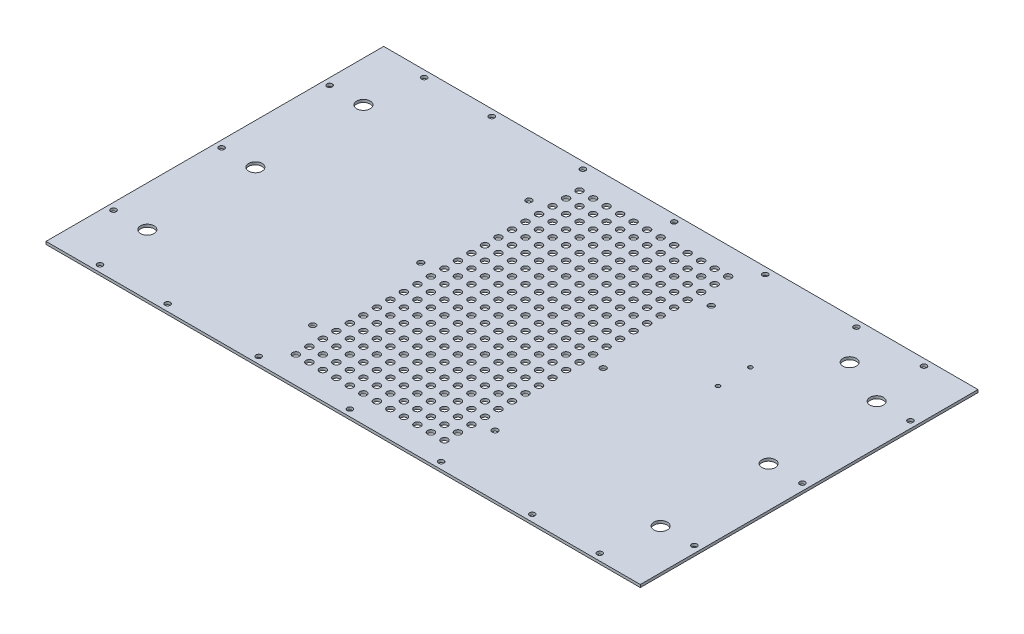
from build123d import *

# Parameters (mm, degrees)
CROQUIS1_W              = 440
CROQUIS1_H              = 250
CROQUIS1_R              = 5
CROQUIS1_R_2            = 2.175
CROQUIS1_W_2            = 120
CROQUIS1_H_2            = 220
SALIENTE_EXTRUIR1_DEPTH = 2
CROQUIS4_W              = 120
CROQUIS4_H              = 220
CROQUIS4_R              = 2.5
SALIENTE_EXTRUIR4_DEPTH = 2
CROQUIS5_R              = 2
CORTAR_EXTRUIR1_DEPTH   = 10
CROQUIS6_R              = 1.5
CORTAR_EXTRUIR2_DEPTH   = 10


with BuildPart() as part:
    # Croquis1 → Saliente-Extruir1 (new body)
    with BuildSketch(Plane(origin=(0, 0, 0), x_dir=(1, 0, 0), z_dir=(0, 1, 0))):
        Rectangle(CROQUIS1_W, CROQUIS1_H)
        with Locations(Location((-190, -80, 0), (0, 0, 270))):
            Circle(CROQUIS1_R, mode=Mode.SUBTRACT)
        with Locations(Location((-190, 0, 0), (0, 0, 270))):
            Circle(CROQUIS1_R, mode=Mode.SUBTRACT)
        with Locations(Location((-190, 80, 0), (0, 0, 270))):
            Circle(CROQUIS1_R, mode=Mode.SUBTRACT)
        with Locations(Location((67.5, 80, 0), (0, 0, 270))):
            Circle(CROQUIS1_R_2, mode=Mode.SUBTRACT)
        with Locations(Location((-67.5, -80, 0), (0, 0, 270))):
            Circle(CROQUIS1_R_2, mode=Mode.SUBTRACT)
        with Locations(Location((-67.5, 0, 0), (0, 0, 270))):
            Circle(CROQUIS1_R_2, mode=Mode.SUBTRACT)
        with Locations(Location((67.5, -80, 0), (0, 0, 270))):
            Circle(CROQUIS1_R_2, mode=Mode.SUBTRACT)
        with Locations(Location((67.5, 0, 0), (0, 0, 270))):
            Circle(CROQUIS1_R_2, mode=Mode.SUBTRACT)
        Rectangle(CROQUIS1_W_2, CROQUIS1_H_2, mode=Mode.SUBTRACT)
        with Locations(Location((-67.5, 80, 0), (0, 0, 270))):
            Circle(CROQUIS1_R_2, mode=Mode.SUBTRACT)
        with Locations(Location((155, 95, 0), (0, 0, 270))):
            Circle(CROQUIS1_R, mode=Mode.SUBTRACT)
        with Locations(Location((190, -80, 0), (0, 0, 270))):
            Circle(CROQUIS1_R, mode=Mode.SUBTRACT)
        with Locations(Location((190, 0, 0), (0, 0, 270))):
            Circle(CROQUIS1_R, mode=Mode.SUBTRACT)
        with Locations(Location((190, 80, 0), (0, 0, 270))):
            Circle(CROQUIS1_R, mode=Mode.SUBTRACT)
    extrude(amount=SALIENTE_EXTRUIR1_DEPTH)

    # Croquis4 → Saliente-Extruir4 (add)
    with BuildSketch(Plane(origin=(0, 2, 0), x_dir=(1, 0, 0), z_dir=(0, 1, 0))):
        Rectangle(CROQUIS4_W, CROQUIS4_H)
        with Locations(Location((-55, 105, 0), (0, 0, 270))):
            Circle(CROQUIS4_R, mode=Mode.SUBTRACT)
        with Locations(Location((-45, 105, 0), (0, 0, 270))):
            Circle(CROQUIS4_R, mode=Mode.SUBTRACT)
        with Locations(Location((-35, 105, 0), (0, 0, 270))):
            Circle(CROQUIS4_R, mode=Mode.SUBTRACT)
        with Locations(Location((-25, 105, 0), (0, 0, 270))):
            Circle(CROQUIS4_R, mode=Mode.SUBTRACT)
        with Locations(Location((-15, 105, 0), (0, 0, 270))):
            Circle(CROQUIS4_R, mode=Mode.SUBTRACT)
        with Locations(Location((-5, 105, 0), (0, 0, 270))):
            Circle(CROQUIS4_R, mode=Mode.SUBTRACT)
        with Locations(Location((5, 105, 0), (0, 0, 270))):
            Circle(CROQUIS4_R, mode=Mode.SUBTRACT)
        with Locations(Location((15, 105, 0), (0, 0, 270))):
            Circle(CROQUIS4_R, mode=Mode.SUBTRACT)
        with Locations(Location((25, 105, 0), (0, 0, 270))):
            Circle(CROQUIS4_R, mode=Mode.SUBTRACT)
        with Locations(Location((35, 105, 0), (0, 0, 270))):
            Circle(CROQUIS4_R, mode=Mode.SUBTRACT)
        with Locations(Location((45, 105, 0), (0, 0, 270))):
            Circle(CROQUIS4_R, mode=Mode.SUBTRACT)
        with Locations(Location((-45, 95, 0), (0, 0, 270))):
            Circle(CROQUIS4_R, mode=Mode.SUBTRACT)
        with Locations(Location((-35, 95, 0), (0, 0, 270))):
            Circle(CROQUIS4_R, mode=Mode.SUBTRACT)
        with Locations(Location((-25, 95, 0), (0, 0, 270))):
            Circle(CROQUIS4_R, mode=Mode.SUBTRACT)
        with Locations(Location((-15, 95, 0), (0, 0, 270))):
            Circle(CROQUIS4_R, mode=Mode.SUBTRACT)
        with Locations(Location((-5, 95, 0), (0, 0, 270))):
            Circle(CROQUIS4_R, mode=Mode.SUBTRACT)
        with Locations(Location((5, 95, 0), (0, 0, 270))):
            Circle(CROQUIS4_R, mode=Mode.SUBTRACT)
        with Locations(Location((15, 95, 0), (0, 0, 270))):
            Circle(CROQUIS4_R, mode=Mode.SUBTRACT)
        with Locations(Location((25, 95, 0), (0, 0, 270))):
            Circle(CROQUIS4_R, mode=Mode.SUBTRACT)
        with Locations(Location((35, 95, 0), (0, 0, 270))):
            Circle(CROQUIS4_R, mode=Mode.SUBTRACT)
        with Locations(Location((45, 95, 0), (0, 0, 270))):
            Circle(CROQUIS4_R, mode=Mode.SUBTRACT)
        with Locations(Location((-45, 85, 0), (0, 0, 270))):
            Circle(CROQUIS4_R, mode=Mode.SUBTRACT)
        with Locations(Location((-35, 85, 0), (0, 0, 270))):
            Circle(CROQUIS4_R, mode=Mode.SUBTRACT)
        with Locations(Location((-25, 85, 0), (0, 0, 270))):
            Circle(CROQUIS4_R, mode=Mode.SUBTRACT)
        with Locations(Location((-15, 85, 0), (0, 0, 270))):
            Circle(CROQUIS4_R, mode=Mode.SUBTRACT)
        with Locations(Location((-5, 85, 0), (0, 0, 270))):
            Circle(CROQUIS4_R, mode=Mode.SUBTRACT)
        with Locations(Location((5, 85, 0), (0, 0, 270))):
            Circle(CROQUIS4_R, mode=Mode.SUBTRACT)
        with Locations(Location((15, 85, 0), (0, 0, 270))):
            Circle(CROQUIS4_R, mode=Mode.SUBTRACT)
        with Locations(Location((25, 85, 0), (0, 0, 270))):
            Circle(CROQUIS4_R, mode=Mode.SUBTRACT)
        with Locations(Location((35, 85, 0), (0, 0, 270))):
            Circle(CROQUIS4_R, mode=Mode.SUBTRACT)
        with Locations(Location((45, 85, 0), (0, 0, 270))):
            Circle(CROQUIS4_R, mode=Mode.SUBTRACT)
        with Locations(Location((-45, 75, 0), (0, 0, 270))):
            Circle(CROQUIS4_R, mode=Mode.SUBTRACT)
        with Locations(Location((-35, 75, 0), (0, 0, 270))):
            Circle(CROQUIS4_R, mode=Mode.SUBTRACT)
        with Locations(Location((-25, 75, 0), (0, 0, 270))):
            Circle(CROQUIS4_R, mode=Mode.SUBTRACT)
        with Locations(Location((-15, 75, 0), (0, 0, 270))):
            Circle(CROQUIS4_R, mode=Mode.SUBTRACT)
        with Locations(Location((-5, 75, 0), (0, 0, 270))):
            Circle(CROQUIS4_R, mode=Mode.SUBTRACT)
        with Locations(Location((5, 75, 0), (0, 0, 270))):
            Circle(CROQUIS4_R, mode=Mode.SUBTRACT)
        with Locations(Location((15, 75, 0), (0, 0, 270))):
            Circle(CROQUIS4_R, mode=Mode.SUBTRACT)
        with Locations(Location((25, 75, 0), (0, 0, 270))):
            Circle(CROQUIS4_R, mode=Mode.SUBTRACT)
        with Locations(Location((35, 75, 0), (0, 0, 270))):
            Circle(CROQUIS4_R, mode=Mode.SUBTRACT)
        with Locations(Location((45, 75, 0), (0, 0, 270))):
            Circle(CROQUIS4_R, mode=Mode.SUBTRACT)
        with Locations(Location((-45, 65, 0), (0, 0, 270))):
            Circle(CROQUIS4_R, mode=Mode.SUBTRACT)
        with Locations(Location((-35, 65, 0), (0, 0, 270))):
            Circle(CROQUIS4_R, mode=Mode.SUBTRACT)
        with Locations(Location((-25, 65, 0), (0, 0, 270))):
            Circle(CROQUIS4_R, mode=Mode.SUBTRACT)
        with Locations(Location((-15, 65, 0), (0, 0, 270))):
            Circle(CROQUIS4_R, mode=Mode.SUBTRACT)
        with Locations(Location((-5, 65, 0), (0, 0, 270))):
            Circle(CROQUIS4_R, mode=Mode.SUBTRACT)
        with Locations(Location((5, 65, 0), (0, 0, 270))):
            Circle(CROQUIS4_R, mode=Mode.SUBTRACT)
        with Locations(Location((15, 65, 0), (0, 0, 270))):
            Circle(CROQUIS4_R, mode=Mode.SUBTRACT)
        with Locations(Location((25, 65, 0), (0, 0, 270))):
            Circle(CROQUIS4_R, mode=Mode.SUBTRACT)
        with Locations(Location((35, 65, 0), (0, 0, 270))):
            Circle(CROQUIS4_R, mode=Mode.SUBTRACT)
        with Locations(Location((45, 65, 0), (0, 0, 270))):
            Circle(CROQUIS4_R, mode=Mode.SUBTRACT)
        with Locations(Location((-45, 55, 0), (0, 0, 270))):
            Circle(CROQUIS4_R, mode=Mode.SUBTRACT)
        with Locations(Location((-35, 55, 0), (0, 0, 270))):
            Circle(CROQUIS4_R, mode=Mode.SUBTRACT)
        with Locations(Location((-25, 55, 0), (0, 0, 270))):
            Circle(CROQUIS4_R, mode=Mode.SUBTRACT)
        with Locations(Location((-15, 55, 0), (0, 0, 270))):
            Circle(CROQUIS4_R, mode=Mode.SUBTRACT)
        with Locations(Location((-5, 55, 0), (0, 0, 270))):
            Circle(CROQUIS4_R, mode=Mode.SUBTRACT)
        with Locations(Location((5, 55, 0), (0, 0, 270))):
            Circle(CROQUIS4_R, mode=Mode.SUBTRACT)
        with Locations(Location((15, 55, 0), (0, 0, 270))):
            Circle(CROQUIS4_R, mode=Mode.SUBTRACT)
        with Locations(Location((25, 55, 0), (0, 0, 270))):
            Circle(CROQUIS4_R, mode=Mode.SUBTRACT)
        with Locations(Location((35, 55, 0), (0, 0, 270))):
            Circle(CROQUIS4_R, mode=Mode.SUBTRACT)
        with Locations(Location((45, 55, 0), (0, 0, 270))):
            Circle(CROQUIS4_R, mode=Mode.SUBTRACT)
        with Locations(Location((-45, 45, 0), (0, 0, 270))):
            Circle(CROQUIS4_R, mode=Mode.SUBTRACT)
        with Locations(Location((-35, 45, 0), (0, 0, 270))):
            Circle(CROQUIS4_R, mode=Mode.SUBTRACT)
        with Locations(Location((-25, 45, 0), (0, 0, 270))):
            Circle(CROQUIS4_R, mode=Mode.SUBTRACT)
        with Locations(Location((-15, 45, 0), (0, 0, 270))):
            Circle(CROQUIS4_R, mode=Mode.SUBTRACT)
        with Locations(Location((-5, 45, 0), (0, 0, 270))):
            Circle(CROQUIS4_R, mode=Mode.SUBTRACT)
        with Locations(Location((5, 45, 0), (0, 0, 270))):
            Circle(CROQUIS4_R, mode=Mode.SUBTRACT)
        with Locations(Location((15, 45, 0), (0, 0, 270))):
            Circle(CROQUIS4_R, mode=Mode.SUBTRACT)
        with Locations(Location((25, 45, 0), (0, 0, 270))):
            Circle(CROQUIS4_R, mode=Mode.SUBTRACT)
        with Locations(Location((35, 45, 0), (0, 0, 270))):
            Circle(CROQUIS4_R, mode=Mode.SUBTRACT)
        with Locations(Location((45, 45, 0), (0, 0, 270))):
            Circle(CROQUIS4_R, mode=Mode.SUBTRACT)
        with Locations(Location((-45, 35, 0), (0, 0, 270))):
            Circle(CROQUIS4_R, mode=Mode.SUBTRACT)
        with Locations(Location((-35, 35, 0), (0, 0, 270))):
            Circle(CROQUIS4_R, mode=Mode.SUBTRACT)
        with Locations(Location((-25, 35, 0), (0, 0, 270))):
            Circle(CROQUIS4_R, mode=Mode.SUBTRACT)
        with Locations(Location((-15, 35, 0), (0, 0, 270))):
            Circle(CROQUIS4_R, mode=Mode.SUBTRACT)
        with Locations(Location((-5, 35, 0), (0, 0, 270))):
            Circle(CROQUIS4_R, mode=Mode.SUBTRACT)
        with Locations(Location((5, 35, 0), (0, 0, 270))):
            Circle(CROQUIS4_R, mode=Mode.SUBTRACT)
        with Locations(Location((15, 35, 0), (0, 0, 270))):
            Circle(CROQUIS4_R, mode=Mode.SUBTRACT)
        with Locations(Location((25, 35, 0), (0, 0, 270))):
            Circle(CROQUIS4_R, mode=Mode.SUBTRACT)
        with Locations(Location((35, 35, 0), (0, 0, 270))):
            Circle(CROQUIS4_R, mode=Mode.SUBTRACT)
        with Locations(Location((45, 35, 0), (0, 0, 270))):
            Circle(CROQUIS4_R, mode=Mode.SUBTRACT)
        with Locations(Location((-45, 25, 0), (0, 0, 270))):
            Circle(CROQUIS4_R, mode=Mode.SUBTRACT)
        with Locations(Location((-35, 25, 0), (0, 0, 270))):
            Circle(CROQUIS4_R, mode=Mode.SUBTRACT)
        with Locations(Location((-25, 25, 0), (0, 0, 270))):
            Circle(CROQUIS4_R, mode=Mode.SUBTRACT)
        with Locations(Location((-15, 25, 0), (0, 0, 270))):
            Circle(CROQUIS4_R, mode=Mode.SUBTRACT)
        with Locations(Location((-5, 25, 0), (0, 0, 270))):
            Circle(CROQUIS4_R, mode=Mode.SUBTRACT)
        with Locations(Location((5, 25, 0), (0, 0, 270))):
            Circle(CROQUIS4_R, mode=Mode.SUBTRACT)
        with Locations(Location((15, 25, 0), (0, 0, 270))):
            Circle(CROQUIS4_R, mode=Mode.SUBTRACT)
        with Locations(Location((25, 25, 0), (0, 0, 270))):
            Circle(CROQUIS4_R, mode=Mode.SUBTRACT)
        with Locations(Location((35, 25, 0), (0, 0, 270))):
            Circle(CROQUIS4_R, mode=Mode.SUBTRACT)
        with Locations(Location((45, 25, 0), (0, 0, 270))):
            Circle(CROQUIS4_R, mode=Mode.SUBTRACT)
        with Locations(Location((-45, 15, 0), (0, 0, 270))):
            Circle(CROQUIS4_R, mode=Mode.SUBTRACT)
        with Locations(Location((-35, 15, 0), (0, 0, 270))):
            Circle(CROQUIS4_R, mode=Mode.SUBTRACT)
        with Locations(Location((-25, 15, 0), (0, 0, 270))):
            Circle(CROQUIS4_R, mode=Mode.SUBTRACT)
        with Locations(Location((-15, 15, 0), (0, 0, 270))):
            Circle(CROQUIS4_R, mode=Mode.SUBTRACT)
        with Locations(Location((-5, 15, 0), (0, 0, 270))):
            Circle(CROQUIS4_R, mode=Mode.SUBTRACT)
        with Locations(Location((5, 15, 0), (0, 0, 270))):
            Circle(CROQUIS4_R, mode=Mode.SUBTRACT)
        with Locations(Location((15, 15, 0), (0, 0, 270))):
            Circle(CROQUIS4_R, mode=Mode.SUBTRACT)
        with Locations(Location((25, 15, 0), (0, 0, 270))):
            Circle(CROQUIS4_R, mode=Mode.SUBTRACT)
        with Locations(Location((35, 15, 0), (0, 0, 270))):
            Circle(CROQUIS4_R, mode=Mode.SUBTRACT)
        with Locations(Location((45, 15, 0), (0, 0, 270))):
            Circle(CROQUIS4_R, mode=Mode.SUBTRACT)
        with Locations(Location((-45, 5, 0), (0, 0, 270))):
            Circle(CROQUIS4_R, mode=Mode.SUBTRACT)
        with Locations(Location((-35, 5, 0), (0, 0, 270))):
            Circle(CROQUIS4_R, mode=Mode.SUBTRACT)
        with Locations(Location((-25, 5, 0), (0, 0, 270))):
            Circle(CROQUIS4_R, mode=Mode.SUBTRACT)
        with Locations(Location((-15, 5, 0), (0, 0, 270))):
            Circle(CROQUIS4_R, mode=Mode.SUBTRACT)
        with Locations(Location((-5, 5, 0), (0, 0, 270))):
            Circle(CROQUIS4_R, mode=Mode.SUBTRACT)
        with Locations(Location((5, 5, 0), (0, 0, 270))):
            Circle(CROQUIS4_R, mode=Mode.SUBTRACT)
        with Locations(Location((15, 5, 0), (0, 0, 270))):
            Circle(CROQUIS4_R, mode=Mode.SUBTRACT)
        with Locations(Location((25, 5, 0), (0, 0, 270))):
            Circle(CROQUIS4_R, mode=Mode.SUBTRACT)
        with Locations(Location((35, 5, 0), (0, 0, 270))):
            Circle(CROQUIS4_R, mode=Mode.SUBTRACT)
        with Locations(Location((45, 5, 0), (0, 0, 270))):
            Circle(CROQUIS4_R, mode=Mode.SUBTRACT)
        with Locations(Location((-45, -5, 0), (0, 0, 270))):
            Circle(CROQUIS4_R, mode=Mode.SUBTRACT)
        with Locations(Location((-35, -5, 0), (0, 0, 270))):
            Circle(CROQUIS4_R, mode=Mode.SUBTRACT)
        with Locations(Location((-25, -5, 0), (0, 0, 270))):
            Circle(CROQUIS4_R, mode=Mode.SUBTRACT)
        with Locations(Location((-15, -5, 0), (0, 0, 270))):
            Circle(CROQUIS4_R, mode=Mode.SUBTRACT)
        with Locations(Location((-5, -5, 0), (0, 0, 270))):
            Circle(CROQUIS4_R, mode=Mode.SUBTRACT)
        with Locations(Location((5, -5, 0), (0, 0, 270))):
            Circle(CROQUIS4_R, mode=Mode.SUBTRACT)
        with Locations(Location((15, -5, 0), (0, 0, 270))):
            Circle(CROQUIS4_R, mode=Mode.SUBTRACT)
        with Locations(Location((25, -5, 0), (0, 0, 270))):
            Circle(CROQUIS4_R, mode=Mode.SUBTRACT)
        with Locations(Location((35, -5, 0), (0, 0, 270))):
            Circle(CROQUIS4_R, mode=Mode.SUBTRACT)
        with Locations(Location((45, -5, 0), (0, 0, 270))):
            Circle(CROQUIS4_R, mode=Mode.SUBTRACT)
        with Locations(Location((-45, -15, 0), (0, 0, 270))):
            Circle(CROQUIS4_R, mode=Mode.SUBTRACT)
        with Locations(Location((-35, -15, 0), (0, 0, 270))):
            Circle(CROQUIS4_R, mode=Mode.SUBTRACT)
        with Locations(Location((-25, -15, 0), (0, 0, 270))):
            Circle(CROQUIS4_R, mode=Mode.SUBTRACT)
        with Locations(Location((-15, -15, 0), (0, 0, 270))):
            Circle(CROQUIS4_R, mode=Mode.SUBTRACT)
        with Locations(Location((-5, -15, 0), (0, 0, 270))):
            Circle(CROQUIS4_R, mode=Mode.SUBTRACT)
        with Locations(Location((5, -15, 0), (0, 0, 270))):
            Circle(CROQUIS4_R, mode=Mode.SUBTRACT)
        with Locations(Location((15, -15, 0), (0, 0, 270))):
            Circle(CROQUIS4_R, mode=Mode.SUBTRACT)
        with Locations(Location((25, -15, 0), (0, 0, 270))):
            Circle(CROQUIS4_R, mode=Mode.SUBTRACT)
        with Locations(Location((35, -15, 0), (0, 0, 270))):
            Circle(CROQUIS4_R, mode=Mode.SUBTRACT)
        with Locations(Location((45, -15, 0), (0, 0, 270))):
            Circle(CROQUIS4_R, mode=Mode.SUBTRACT)
        with Locations(Location((-45, -25, 0), (0, 0, 270))):
            Circle(CROQUIS4_R, mode=Mode.SUBTRACT)
        with Locations(Location((-35, -25, 0), (0, 0, 270))):
            Circle(CROQUIS4_R, mode=Mode.SUBTRACT)
        with Locations(Location((-25, -25, 0), (0, 0, 270))):
            Circle(CROQUIS4_R, mode=Mode.SUBTRACT)
        with Locations(Location((-15, -25, 0), (0, 0, 270))):
            Circle(CROQUIS4_R, mode=Mode.SUBTRACT)
        with Locations(Location((-5, -25, 0), (0, 0, 270))):
            Circle(CROQUIS4_R, mode=Mode.SUBTRACT)
        with Locations(Location((5, -25, 0), (0, 0, 270))):
            Circle(CROQUIS4_R, mode=Mode.SUBTRACT)
        with Locations(Location((15, -25, 0), (0, 0, 270))):
            Circle(CROQUIS4_R, mode=Mode.SUBTRACT)
        with Locations(Location((25, -25, 0), (0, 0, 270))):
            Circle(CROQUIS4_R, mode=Mode.SUBTRACT)
        with Locations(Location((35, -25, 0), (0, 0, 270))):
            Circle(CROQUIS4_R, mode=Mode.SUBTRACT)
        with Locations(Location((45, -25, 0), (0, 0, 270))):
            Circle(CROQUIS4_R, mode=Mode.SUBTRACT)
        with Locations(Location((-45, -35, 0), (0, 0, 270))):
            Circle(CROQUIS4_R, mode=Mode.SUBTRACT)
        with Locations(Location((-35, -35, 0), (0, 0, 270))):
            Circle(CROQUIS4_R, mode=Mode.SUBTRACT)
        with Locations(Location((-25, -35, 0), (0, 0, 270))):
            Circle(CROQUIS4_R, mode=Mode.SUBTRACT)
        with Locations(Location((-15, -35, 0), (0, 0, 270))):
            Circle(CROQUIS4_R, mode=Mode.SUBTRACT)
        with Locations(Location((-5, -35, 0), (0, 0, 270))):
            Circle(CROQUIS4_R, mode=Mode.SUBTRACT)
        with Locations(Location((5, -35, 0), (0, 0, 270))):
            Circle(CROQUIS4_R, mode=Mode.SUBTRACT)
        with Locations(Location((15, -35, 0), (0, 0, 270))):
            Circle(CROQUIS4_R, mode=Mode.SUBTRACT)
        with Locations(Location((25, -35, 0), (0, 0, 270))):
            Circle(CROQUIS4_R, mode=Mode.SUBTRACT)
        with Locations(Location((35, -35, 0), (0, 0, 270))):
            Circle(CROQUIS4_R, mode=Mode.SUBTRACT)
        with Locations(Location((45, -35, 0), (0, 0, 270))):
            Circle(CROQUIS4_R, mode=Mode.SUBTRACT)
        with Locations(Location((-45, -45, 0), (0, 0, 270))):
            Circle(CROQUIS4_R, mode=Mode.SUBTRACT)
        with Locations(Location((-35, -45, 0), (0, 0, 270))):
            Circle(CROQUIS4_R, mode=Mode.SUBTRACT)
        with Locations(Location((-25, -45, 0), (0, 0, 270))):
            Circle(CROQUIS4_R, mode=Mode.SUBTRACT)
        with Locations(Location((-15, -45, 0), (0, 0, 270))):
            Circle(CROQUIS4_R, mode=Mode.SUBTRACT)
        with Locations(Location((-5, -45, 0), (0, 0, 270))):
            Circle(CROQUIS4_R, mode=Mode.SUBTRACT)
        with Locations(Location((5, -45, 0), (0, 0, 270))):
            Circle(CROQUIS4_R, mode=Mode.SUBTRACT)
        with Locations(Location((15, -45, 0), (0, 0, 270))):
            Circle(CROQUIS4_R, mode=Mode.SUBTRACT)
        with Locations(Location((25, -45, 0), (0, 0, 270))):
            Circle(CROQUIS4_R, mode=Mode.SUBTRACT)
        with Locations(Location((35, -45, 0), (0, 0, 270))):
            Circle(CROQUIS4_R, mode=Mode.SUBTRACT)
        with Locations(Location((45, -45, 0), (0, 0, 270))):
            Circle(CROQUIS4_R, mode=Mode.SUBTRACT)
        with Locations(Location((-45, -55, 0), (0, 0, 270))):
            Circle(CROQUIS4_R, mode=Mode.SUBTRACT)
        with Locations(Location((-35, -55, 0), (0, 0, 270))):
            Circle(CROQUIS4_R, mode=Mode.SUBTRACT)
        with Locations(Location((-25, -55, 0), (0, 0, 270))):
            Circle(CROQUIS4_R, mode=Mode.SUBTRACT)
        with Locations(Location((-15, -55, 0), (0, 0, 270))):
            Circle(CROQUIS4_R, mode=Mode.SUBTRACT)
        with Locations(Location((-5, -55, 0), (0, 0, 270))):
            Circle(CROQUIS4_R, mode=Mode.SUBTRACT)
        with Locations(Location((5, -55, 0), (0, 0, 270))):
            Circle(CROQUIS4_R, mode=Mode.SUBTRACT)
        with Locations(Location((15, -55, 0), (0, 0, 270))):
            Circle(CROQUIS4_R, mode=Mode.SUBTRACT)
        with Locations(Location((25, -55, 0), (0, 0, 270))):
            Circle(CROQUIS4_R, mode=Mode.SUBTRACT)
        with Locations(Location((35, -55, 0), (0, 0, 270))):
            Circle(CROQUIS4_R, mode=Mode.SUBTRACT)
        with Locations(Location((45, -55, 0), (0, 0, 270))):
            Circle(CROQUIS4_R, mode=Mode.SUBTRACT)
        with Locations(Location((-45, -65, 0), (0, 0, 270))):
            Circle(CROQUIS4_R, mode=Mode.SUBTRACT)
        with Locations(Location((-35, -65, 0), (0, 0, 270))):
            Circle(CROQUIS4_R, mode=Mode.SUBTRACT)
        with Locations(Location((-25, -65, 0), (0, 0, 270))):
            Circle(CROQUIS4_R, mode=Mode.SUBTRACT)
        with Locations(Location((-15, -65, 0), (0, 0, 270))):
            Circle(CROQUIS4_R, mode=Mode.SUBTRACT)
        with Locations(Location((-5, -65, 0), (0, 0, 270))):
            Circle(CROQUIS4_R, mode=Mode.SUBTRACT)
        with Locations(Location((5, -65, 0), (0, 0, 270))):
            Circle(CROQUIS4_R, mode=Mode.SUBTRACT)
        with Locations(Location((15, -65, 0), (0, 0, 270))):
            Circle(CROQUIS4_R, mode=Mode.SUBTRACT)
        with Locations(Location((25, -65, 0), (0, 0, 270))):
            Circle(CROQUIS4_R, mode=Mode.SUBTRACT)
        with Locations(Location((35, -65, 0), (0, 0, 270))):
            Circle(CROQUIS4_R, mode=Mode.SUBTRACT)
        with Locations(Location((45, -65, 0), (0, 0, 270))):
            Circle(CROQUIS4_R, mode=Mode.SUBTRACT)
        with Locations(Location((-45, -75, 0), (0, 0, 270))):
            Circle(CROQUIS4_R, mode=Mode.SUBTRACT)
        with Locations(Location((-35, -75, 0), (0, 0, 270))):
            Circle(CROQUIS4_R, mode=Mode.SUBTRACT)
        with Locations(Location((-25, -75, 0), (0, 0, 270))):
            Circle(CROQUIS4_R, mode=Mode.SUBTRACT)
        with Locations(Location((-15, -75, 0), (0, 0, 270))):
            Circle(CROQUIS4_R, mode=Mode.SUBTRACT)
        with Locations(Location((-5, -75, 0), (0, 0, 270))):
            Circle(CROQUIS4_R, mode=Mode.SUBTRACT)
        with Locations(Location((5, -75, 0), (0, 0, 270))):
            Circle(CROQUIS4_R, mode=Mode.SUBTRACT)
        with Locations(Location((15, -75, 0), (0, 0, 270))):
            Circle(CROQUIS4_R, mode=Mode.SUBTRACT)
        with Locations(Location((25, -75, 0), (0, 0, 270))):
            Circle(CROQUIS4_R, mode=Mode.SUBTRACT)
        with Locations(Location((35, -75, 0), (0, 0, 270))):
            Circle(CROQUIS4_R, mode=Mode.SUBTRACT)
        with Locations(Location((45, -75, 0), (0, 0, 270))):
            Circle(CROQUIS4_R, mode=Mode.SUBTRACT)
        with Locations(Location((-45, -85, 0), (0, 0, 270))):
            Circle(CROQUIS4_R, mode=Mode.SUBTRACT)
        with Locations(Location((-35, -85, 0), (0, 0, 270))):
            Circle(CROQUIS4_R, mode=Mode.SUBTRACT)
        with Locations(Location((-25, -85, 0), (0, 0, 270))):
            Circle(CROQUIS4_R, mode=Mode.SUBTRACT)
        with Locations(Location((-15, -85, 0), (0, 0, 270))):
            Circle(CROQUIS4_R, mode=Mode.SUBTRACT)
        with Locations(Location((-5, -85, 0), (0, 0, 270))):
            Circle(CROQUIS4_R, mode=Mode.SUBTRACT)
        with Locations(Location((5, -85, 0), (0, 0, 270))):
            Circle(CROQUIS4_R, mode=Mode.SUBTRACT)
        with Locations(Location((15, -85, 0), (0, 0, 270))):
            Circle(CROQUIS4_R, mode=Mode.SUBTRACT)
        with Locations(Location((25, -85, 0), (0, 0, 270))):
            Circle(CROQUIS4_R, mode=Mode.SUBTRACT)
        with Locations(Location((35, -85, 0), (0, 0, 270))):
            Circle(CROQUIS4_R, mode=Mode.SUBTRACT)
        with Locations(Location((45, -85, 0), (0, 0, 270))):
            Circle(CROQUIS4_R, mode=Mode.SUBTRACT)
        with Locations(Location((-45, -95, 0), (0, 0, 270))):
            Circle(CROQUIS4_R, mode=Mode.SUBTRACT)
        with Locations(Location((-35, -95, 0), (0, 0, 270))):
            Circle(CROQUIS4_R, mode=Mode.SUBTRACT)
        with Locations(Location((-25, -95, 0), (0, 0, 270))):
            Circle(CROQUIS4_R, mode=Mode.SUBTRACT)
        with Locations(Location((-15, -95, 0), (0, 0, 270))):
            Circle(CROQUIS4_R, mode=Mode.SUBTRACT)
        with Locations(Location((-5, -95, 0), (0, 0, 270))):
            Circle(CROQUIS4_R, mode=Mode.SUBTRACT)
        with Locations(Location((5, -95, 0), (0, 0, 270))):
            Circle(CROQUIS4_R, mode=Mode.SUBTRACT)
        with Locations(Location((15, -95, 0), (0, 0, 270))):
            Circle(CROQUIS4_R, mode=Mode.SUBTRACT)
        with Locations(Location((25, -95, 0), (0, 0, 270))):
            Circle(CROQUIS4_R, mode=Mode.SUBTRACT)
        with Locations(Location((35, -95, 0), (0, 0, 270))):
            Circle(CROQUIS4_R, mode=Mode.SUBTRACT)
        with Locations(Location((45, -95, 0), (0, 0, 270))):
            Circle(CROQUIS4_R, mode=Mode.SUBTRACT)
        with Locations(Location((-55, 95, 0), (0, 0, 270))):
            Circle(CROQUIS4_R, mode=Mode.SUBTRACT)
        with Locations(Location((-55, 85, 0), (0, 0, 270))):
            Circle(CROQUIS4_R, mode=Mode.SUBTRACT)
        with Locations(Location((-55, 75, 0), (0, 0, 270))):
            Circle(CROQUIS4_R, mode=Mode.SUBTRACT)
        with Locations(Location((-55, 65, 0), (0, 0, 270))):
            Circle(CROQUIS4_R, mode=Mode.SUBTRACT)
        with Locations(Location((-55, 55, 0), (0, 0, 270))):
            Circle(CROQUIS4_R, mode=Mode.SUBTRACT)
        with Locations(Location((-55, 45, 0), (0, 0, 270))):
            Circle(CROQUIS4_R, mode=Mode.SUBTRACT)
        with Locations(Location((-55, 35, 0), (0, 0, 270))):
            Circle(CROQUIS4_R, mode=Mode.SUBTRACT)
        with Locations(Location((-55, 25, 0), (0, 0, 270))):
            Circle(CROQUIS4_R, mode=Mode.SUBTRACT)
        with Locations(Location((-55, 15, 0), (0, 0, 270))):
            Circle(CROQUIS4_R, mode=Mode.SUBTRACT)
        with Locations(Location((-55, 5, 0), (0, 0, 270))):
            Circle(CROQUIS4_R, mode=Mode.SUBTRACT)
        with Locations(Location((-55, -5, 0), (0, 0, 270))):
            Circle(CROQUIS4_R, mode=Mode.SUBTRACT)
        with Locations(Location((-55, -15, 0), (0, 0, 270))):
            Circle(CROQUIS4_R, mode=Mode.SUBTRACT)
        with Locations(Location((-55, -25, 0), (0, 0, 270))):
            Circle(CROQUIS4_R, mode=Mode.SUBTRACT)
        with Locations(Location((-55, -35, 0), (0, 0, 270))):
            Circle(CROQUIS4_R, mode=Mode.SUBTRACT)
        with Locations(Location((-55, -45, 0), (0, 0, 270))):
            Circle(CROQUIS4_R, mode=Mode.SUBTRACT)
        with Locations(Location((-55, -55, 0), (0, 0, 270))):
            Circle(CROQUIS4_R, mode=Mode.SUBTRACT)
        with Locations(Location((-55, -65, 0), (0, 0, 270))):
            Circle(CROQUIS4_R, mode=Mode.SUBTRACT)
        with Locations(Location((-55, -75, 0), (0, 0, 270))):
            Circle(CROQUIS4_R, mode=Mode.SUBTRACT)
        with Locations(Location((-55, -85, 0), (0, 0, 270))):
            Circle(CROQUIS4_R, mode=Mode.SUBTRACT)
        with Locations(Location((-55, -95, 0), (0, 0, 270))):
            Circle(CROQUIS4_R, mode=Mode.SUBTRACT)
        with Locations(Location((55, 105, 0), (0, 0, 270))):
            Circle(CROQUIS4_R, mode=Mode.SUBTRACT)
        with Locations(Location((55, 95, 0), (0, 0, 270))):
            Circle(CROQUIS4_R, mode=Mode.SUBTRACT)
        with Locations(Location((55, 85, 0), (0, 0, 270))):
            Circle(CROQUIS4_R, mode=Mode.SUBTRACT)
        with Locations(Location((55, 75, 0), (0, 0, 270))):
            Circle(CROQUIS4_R, mode=Mode.SUBTRACT)
        with Locations(Location((55, 65, 0), (0, 0, 270))):
            Circle(CROQUIS4_R, mode=Mode.SUBTRACT)
        with Locations(Location((55, 55, 0), (0, 0, 270))):
            Circle(CROQUIS4_R, mode=Mode.SUBTRACT)
        with Locations(Location((55, 45, 0), (0, 0, 270))):
            Circle(CROQUIS4_R, mode=Mode.SUBTRACT)
        with Locations(Location((55, 35, 0), (0, 0, 270))):
            Circle(CROQUIS4_R, mode=Mode.SUBTRACT)
        with Locations(Location((55, 25, 0), (0, 0, 270))):
            Circle(CROQUIS4_R, mode=Mode.SUBTRACT)
        with Locations(Location((55, 15, 0), (0, 0, 270))):
            Circle(CROQUIS4_R, mode=Mode.SUBTRACT)
        with Locations(Location((55, 5, 0), (0, 0, 270))):
            Circle(CROQUIS4_R, mode=Mode.SUBTRACT)
        with Locations(Location((55, -5, 0), (0, 0, 270))):
            Circle(CROQUIS4_R, mode=Mode.SUBTRACT)
        with Locations(Location((55, -15, 0), (0, 0, 270))):
            Circle(CROQUIS4_R, mode=Mode.SUBTRACT)
        with Locations(Location((55, -25, 0), (0, 0, 270))):
            Circle(CROQUIS4_R, mode=Mode.SUBTRACT)
        with Locations(Location((55, -35, 0), (0, 0, 270))):
            Circle(CROQUIS4_R, mode=Mode.SUBTRACT)
        with Locations(Location((55, -45, 0), (0, 0, 270))):
            Circle(CROQUIS4_R, mode=Mode.SUBTRACT)
        with Locations(Location((55, -55, 0), (0, 0, 270))):
            Circle(CROQUIS4_R, mode=Mode.SUBTRACT)
        with Locations(Location((55, -65, 0), (0, 0, 270))):
            Circle(CROQUIS4_R, mode=Mode.SUBTRACT)
        with Locations(Location((55, -75, 0), (0, 0, 270))):
            Circle(CROQUIS4_R, mode=Mode.SUBTRACT)
        with Locations(Location((55, -85, 0), (0, 0, 270))):
            Circle(CROQUIS4_R, mode=Mode.SUBTRACT)
        with Locations(Location((55, -95, 0), (0, 0, 270))):
            Circle(CROQUIS4_R, mode=Mode.SUBTRACT)
        with Locations(Location((-55, -105, 0), (0, 0, 270))):
            Circle(CROQUIS4_R, mode=Mode.SUBTRACT)
        with Locations(Location((-45, -105, 0), (0, 0, 270))):
            Circle(CROQUIS4_R, mode=Mode.SUBTRACT)
        with Locations(Location((-35, -105, 0), (0, 0, 270))):
            Circle(CROQUIS4_R, mode=Mode.SUBTRACT)
        with Locations(Location((-25, -105, 0), (0, 0, 270))):
            Circle(CROQUIS4_R, mode=Mode.SUBTRACT)
        with Locations(Location((-15, -105, 0), (0, 0, 270))):
            Circle(CROQUIS4_R, mode=Mode.SUBTRACT)
        with Locations(Location((-5, -105, 0), (0, 0, 270))):
            Circle(CROQUIS4_R, mode=Mode.SUBTRACT)
        with Locations(Location((5, -105, 0), (0, 0, 270))):
            Circle(CROQUIS4_R, mode=Mode.SUBTRACT)
        with Locations(Location((15, -105, 0), (0, 0, 270))):
            Circle(CROQUIS4_R, mode=Mode.SUBTRACT)
        with Locations(Location((25, -105, 0), (0, 0, 270))):
            Circle(CROQUIS4_R, mode=Mode.SUBTRACT)
        with Locations(Location((35, -105, 0), (0, 0, 270))):
            Circle(CROQUIS4_R, mode=Mode.SUBTRACT)
        with Locations(Location((45, -105, 0), (0, 0, 270))):
            Circle(CROQUIS4_R, mode=Mode.SUBTRACT)
        with Locations(Location((55, -105, 0), (0, 0, 270))):
            Circle(CROQUIS4_R, mode=Mode.SUBTRACT)
    extrude(amount=-SALIENTE_EXTRUIR4_DEPTH)

    # Croquis5 → Cortar-Extruir1 (cut)
    with BuildSketch(Plane(origin=(0, 2, 0), x_dir=(1, 0, 0), z_dir=(0, 1, 0))):
        with Locations(Location((0, 120, 0), (0, 0, 270))):
            Circle(CROQUIS5_R)
        with Locations(Location((0, -120, 0), (0, 0, 270))):
            Circle(CROQUIS5_R)
        with Locations(Location((-215, 80, 0), (0, 0, 270))):
            Circle(CROQUIS5_R)
        with Locations(Location((-215, 0, 0), (0, 0, 270))):
            Circle(CROQUIS5_R)
        with Locations(Location((-215, -80, 0), (0, 0, 270))):
            Circle(CROQUIS5_R)
        with Locations(Location((-67.5, -120, 0), (0, 0, 270))):
            Circle(CROQUIS5_R)
        with Locations(Location((67.5, -120, 0), (0, 0, 270))):
            Circle(CROQUIS5_R)
        with Locations(Location((-67.5, 120, 0), (0, 0, 270))):
            Circle(CROQUIS5_R)
        with Locations(Location((215, 80, 0), (0, 0, 270))):
            Circle(CROQUIS5_R)
        with Locations(Location((215, 0, 0), (0, 0, 270))):
            Circle(CROQUIS5_R)
        with Locations(Location((215, -80, 0), (0, 0, 270))):
            Circle(CROQUIS5_R)
        with Locations(Location((67.5, 120, 0), (0, 0, 270))):
            Circle(CROQUIS5_R)
        with Locations(Location((-185, 120, 0), (0, 0, 270))):
            Circle(CROQUIS5_R)
        with Locations(Location((-135, 120, 0), (0, 0, 270))):
            Circle(CROQUIS5_R)
        with Locations(Location((-185, -120, 0), (0, 0, 270))):
            Circle(CROQUIS5_R)
        with Locations(Location((-135, -120, 0), (0, 0, 270))):
            Circle(CROQUIS5_R)
        with Locations(Location((135, 120, 0), (0, 0, 270))):
            Circle(CROQUIS5_R)
        with Locations(Location((185, 120, 0), (0, 0, 270))):
            Circle(CROQUIS5_R)
        with Locations(Location((135, -120, 0), (0, 0, 270))):
            Circle(CROQUIS5_R)
        with Locations(Location((185, -120, 0), (0, 0, 270))):
            Circle(CROQUIS5_R)
    extrude(amount=-CORTAR_EXTRUIR1_DEPTH, mode=Mode.SUBTRACT)

    # Croquis6 → Cortar-Extruir2 (cut)
    with BuildSketch(Plane(origin=(0, 2, 0), x_dir=(1, 0, 0), z_dir=(0, 1, 0))):
        with Locations(Location((121.5, 55, 0), (0, 0, 270))):
            Circle(CROQUIS6_R)
        with Locations(Location((121.5, 31, 0), (0, 0, 270))):
            Circle(CROQUIS6_R)
    extrude(amount=-CORTAR_EXTRUIR2_DEPTH, mode=Mode.SUBTRACT)


solid = part.part
